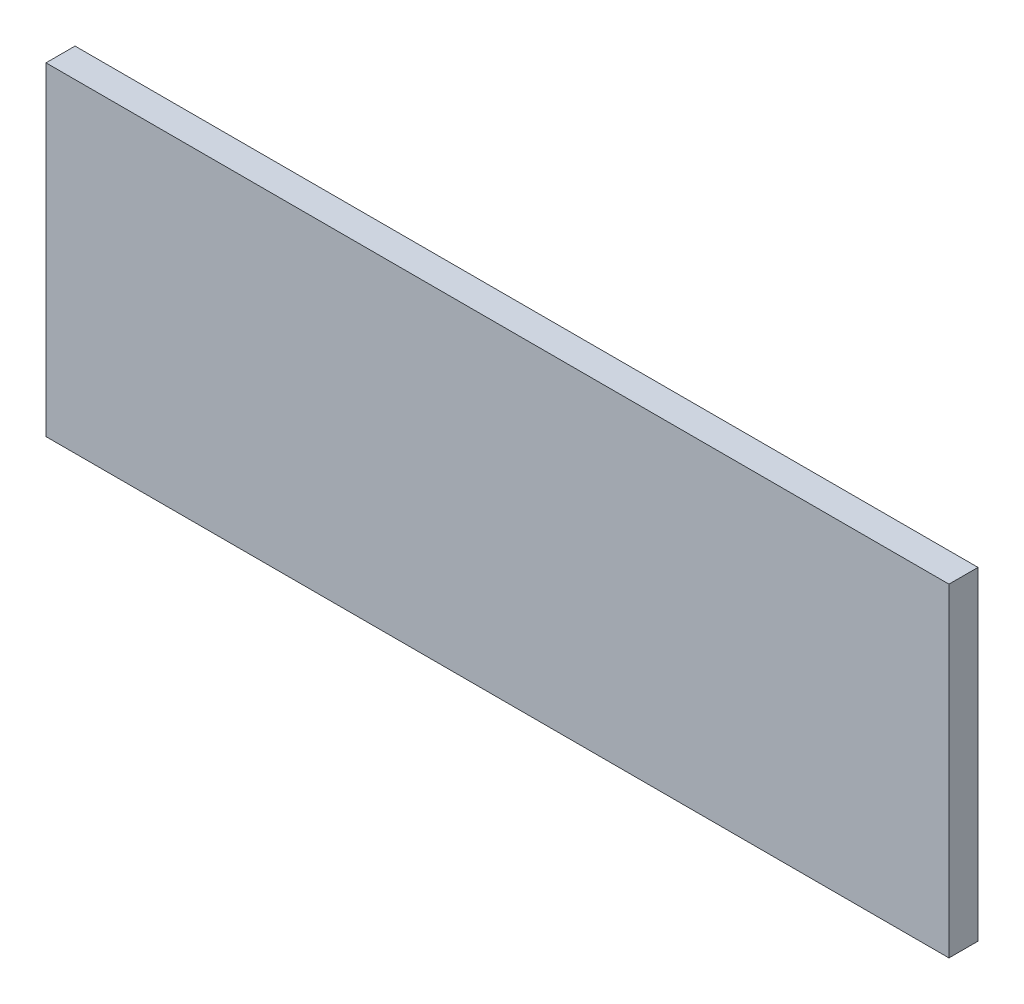
from build123d import *

# Parameters (mm, degrees)
ESBO_O1_W                = 62.2
ESBO_O1_H                = 22.3
RESSALTO_EXTRUS_O1_DEPTH = 2


with BuildPart() as part:
    # Esboço1 → Ressalto-extrusão1 (new body)
    with BuildSketch(Plane.XY):
        Rectangle(ESBO_O1_W, ESBO_O1_H)
    extrude(amount=RESSALTO_EXTRUS_O1_DEPTH)


solid = part.part
